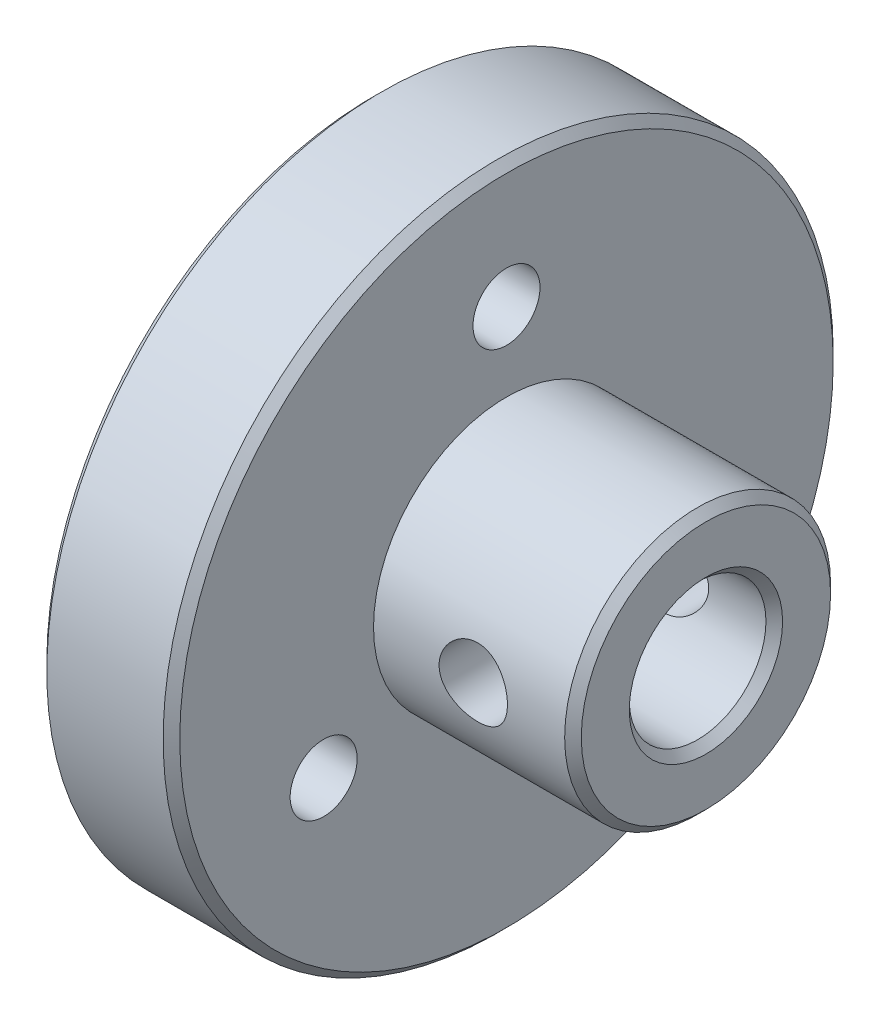
from build123d import *

# Parameters (mm, degrees)
PIN_CUT_DEPTH                  = 28.640832567
PIN_CUT_DEPTH_BACK             = 28.640832567
SKETCH3_R                      = 1.63195
SKETCH2_R                      = 1.6
F_3MM_CLOSE_FIT_BOLT_CUT_DEPTH = 25.550471012
CHAMFER1_SIZE                  = 0.396875


with BuildPart() as part:
    # Sketch1 → Revolve1 (revolve)
    with BuildSketch(Plane.XY, mode=Mode.PRIVATE) as revolve1_sk:
        Polygon((0, 3.2639), (0, 6.35), (-9.525, 6.35), (-9.525, 16), (-15.875, 16), (-15.875, 5), (-14.0716, 5), (-14.0716, 3.2639), align=None)
    revolve(revolve1_sk.sketch.rotate(Axis((0, 0, 0), (-1, 0, 0)), 90), axis=Axis((0, 0, 0), (-1, 0, 0)))

    # Sketch3 → Pin Cut (cut, two sides: drawn at the far end of the back side and taken through both)
    with BuildSketch(Plane.XY.offset(-PIN_CUT_DEPTH_BACK)):
        with Locations((-4.7625, 0)):
            Circle(SKETCH3_R)
    extrude(amount=PIN_CUT_DEPTH + PIN_CUT_DEPTH_BACK, mode=Mode.SUBTRACT)

    # Sketch2 → 3mm Close Fit Bolt Cut (cut, through all)
    with BuildSketch(Plane(origin=(-9.525, 0, 0), x_dir=(0, 0, -1), z_dir=(1, 0, 0))):
        with Locations((0, 10.082498691)):
            Circle(SKETCH2_R)
        with Locations((-8.7317, -5.041249345)):
            Circle(SKETCH2_R)
        with Locations((8.7317, -5.041249345)):
            Circle(SKETCH2_R)
    extrude(amount=-F_3MM_CLOSE_FIT_BOLT_CUT_DEPTH, mode=Mode.SUBTRACT)

    # Chamfer1
    chamfer1_edges = [part.edges().sort_by_distance(p)[0] for p in [
        (0, 0, 3.2639),
        (-15.875, 0, 16),
        (-9.525, 0, 16),
        (0, 0, 6.35),
    ]]
    chamfer(chamfer1_edges, length=CHAMFER1_SIZE)


solid = part.part
